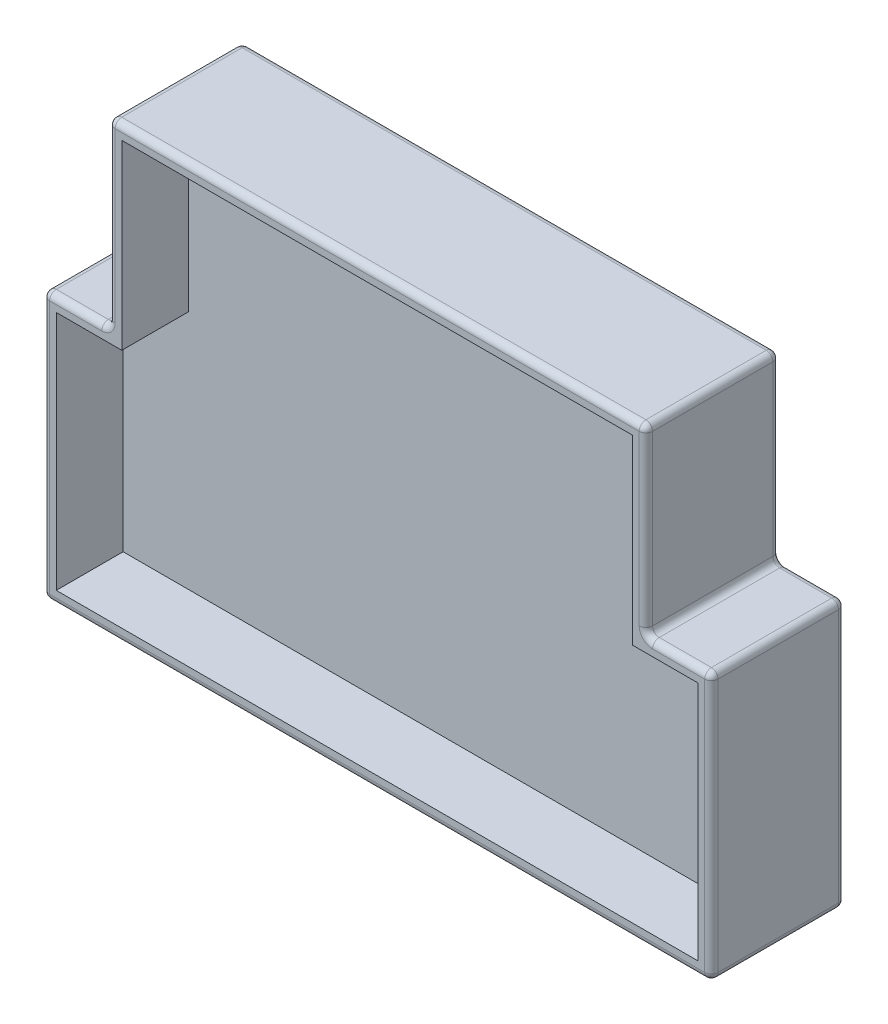
from build123d import *

# Parameters (mm, degrees)
SKETCH_1_W          = 100
SKETCH_1_H          = 40
EXTRUDE_1_DEPTH     = 20
SKETCH_2_W          = 96
SKETCH_2_H          = 36
CUT_EXTRUDE_1_DEPTH = 10
SKETCH_3_W          = 80.4
SKETCH_3_H          = 20
EXTRUDE_2_DEPTH     = 27.2
CUT_EXTRUDE_2_DEPTH = 27.2
FILLET_1_R          = 1


with BuildPart() as part:
    # Эскиз1 → Бобышка-Вытянуть1 (new body)
    with BuildSketch(Plane.XY):
        Rectangle(SKETCH_1_W, SKETCH_1_H)
    extrude(amount=EXTRUDE_1_DEPTH)

    # Эскиз2 → Вырез-Вытянуть1 (cut)
    with BuildSketch(Plane.XY.offset(20)):
        Rectangle(SKETCH_2_W, SKETCH_2_H)
    extrude(amount=-CUT_EXTRUDE_1_DEPTH, mode=Mode.SUBTRACT)

    # Эскиз3 → Бобышка-Вытянуть2 (add)
    with BuildSketch(Plane(origin=(0, 20, 0), x_dir=(1, 0, 0), z_dir=(0, 1, 0))):
        with Locations((0, -10)):
            Rectangle(SKETCH_3_W, SKETCH_3_H)
    extrude(amount=EXTRUDE_2_DEPTH)

    # Эскиз4 → Вырез-Вытянуть2 (cut)
    with BuildSketch(Plane.XZ.offset(-18)):
        Polygon((-38.2, 20), (0, 20), (38.2, 20), (38.2, 10), (-38.2, 10), align=None)
    extrude(amount=-CUT_EXTRUDE_2_DEPTH, mode=Mode.SUBTRACT)

    # Скругление1
    fillet_1_edges = [part.edges().sort_by_distance(p)[0] for p in [
        (50, 0, 20),
        (45.1, 20, 20),
        (-45.1, 20, 0),
        (-45.1, 20, 20),
        (-40.2, 33.6, 20),
        (40.2, 20, 10),
        (40.2, 33.6, 20),
        (40.2, 33.6, 0),
        (-40.2, 20, 10),
        (-40.2, 33.6, 0),
        (0, 47.2, 20),
        (40.2, 47.2, 10),
        (0, 47.2, 0),
        (-40.2, 47.2, 10),
        (-50, 0, 20),
        (45.1, 20, 0),
        (50, 0, 0),
        (0, -20, 0),
        (-50, 0, 0),
        (-50, 20, 10),
        (50, 20, 10),
        (50, -20, 10),
        (-50, -20, 10),
        (0, -20, 20),
    ]]
    fillet(fillet_1_edges, radius=FILLET_1_R)


solid = part.part
